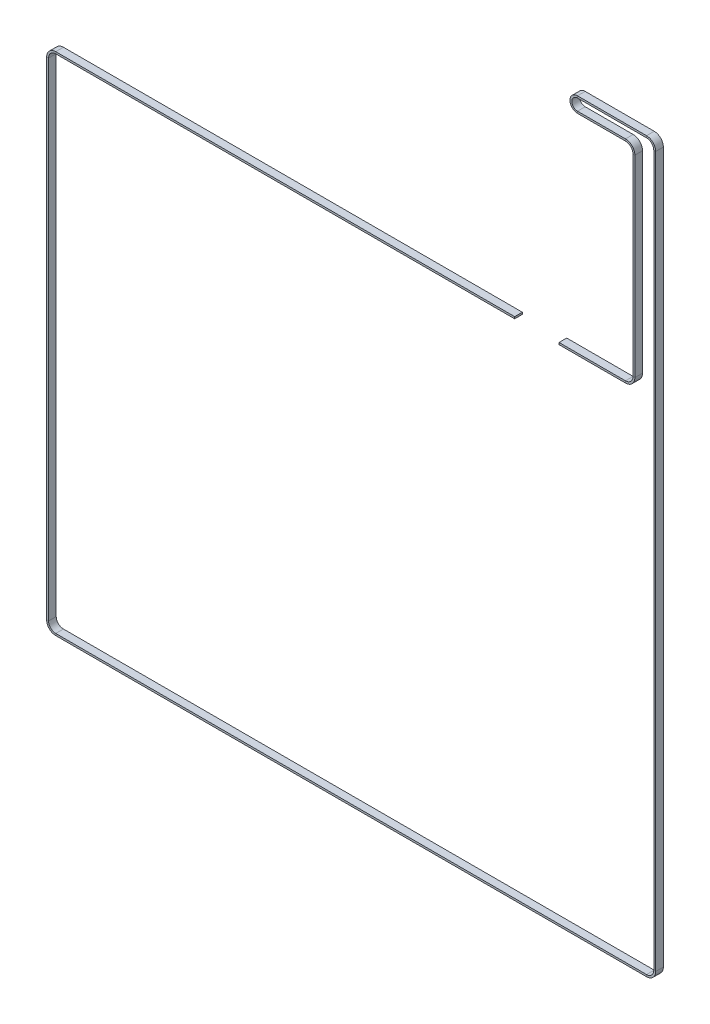
from build123d import *

# Parameters (mm, degrees)
SKETCH4_W = 6
SKETCH4_H = 1.5


with BuildPart() as part:
    # Sweep1: sweep along a path in Sketch1
    with BuildLine(Plane.XY) as sweep1_path:
        Line((328.167855181, -316.381930234), (-30.687774041, -316.381930234))
        ThreePointArc((-30.687774041, -316.381930234), (-35.195579771, -318.249124504), (-37.062774041, -322.756930234))
        Line((-37.062774041, -322.756930234), (-37.062774041, -703.985411885))
        ThreePointArc((-37.062774041, -703.985411885), (-35.195579771, -708.493217615), (-30.687774041, -710.360411885))
        Line((-30.687774041, -710.360411885), (431.312225959, -710.360411885))
        ThreePointArc((431.312225959, -710.360411885), (435.820031689, -708.493217615), (437.687225959, -703.985411885))
        Line((437.687225959, -703.985411885), (437.687225959, -148.660411885))
        ThreePointArc((437.687225959, -148.660411885), (435.820031689, -144.152606155), (431.312225959, -142.285411885))
        Line((431.312225959, -142.285411885), (377.312225959, -142.285411885))
        ThreePointArc((377.312225959, -142.285411885), (372.112225959, -147.485411885), (377.312225959, -152.685411885))
        Line((377.312225959, -152.685411885), (414.812225959, -152.685411885))
        ThreePointArc((414.812225959, -152.685411885), (419.479130714, -154.618507129), (421.412225959, -159.285411885))
        Line((421.412225959, -159.285411885), (421.412225959, -309.931930234))
        ThreePointArc((421.412225959, -309.931930234), (419.479130714, -314.59883499), (414.812225959, -316.531930234))
        Line((414.812225959, -316.531930234), (362.867855181, -316.531930234))
    # Sketch4 → Sweep1 (sweep)
    with BuildSketch(Plane(origin=(328.167855181, -316.381930234, 0), x_dir=(0, 0, -1), z_dir=(1, 0, 0))):
        Rectangle(SKETCH4_W, SKETCH4_H)
    sweep(path=sweep1_path.line)


solid = part.part
